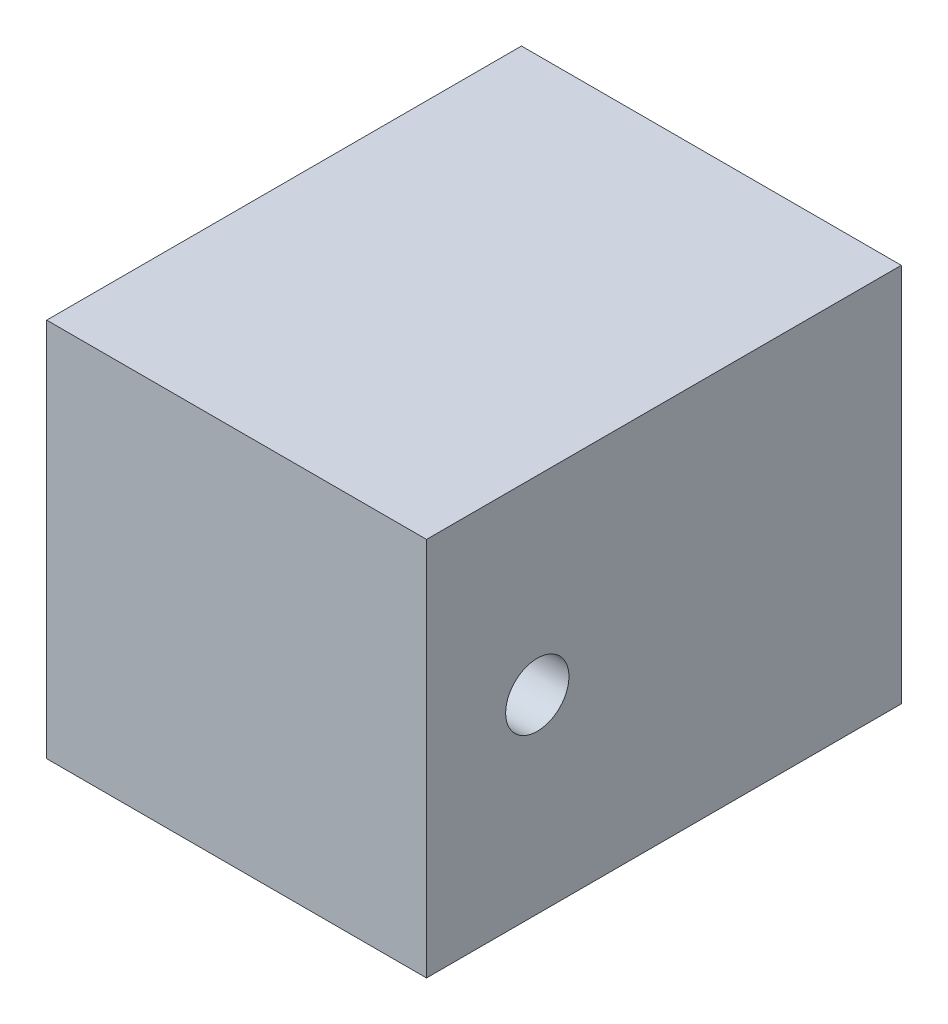
from build123d import *

# Parameters (mm, degrees)
SKETCH_1_W          = 12
SKETCH_1_H          = 12
SKETCH_1_W_2        = 10
SKETCH_1_H_2        = 10
EXTRUDE_1_DEPTH     = 10
SKETCH_2_W          = 12
SKETCH_2_H          = 12
EXTRUDE_2_DEPTH     = 5
SKETCH_3_R          = 1
CUT_EXTRUDE_1_DEPTH = 12


with BuildPart() as part:
    # 草图1 → 凸台-拉伸1 (new body)
    with BuildSketch(Plane.XY):
        with Locations((6, 6)):
            Rectangle(SKETCH_1_W, SKETCH_1_H)
        with Locations((6, 6)):
            Rectangle(SKETCH_1_W_2, SKETCH_1_H_2, mode=Mode.SUBTRACT)
    extrude(amount=EXTRUDE_1_DEPTH)

    # 草图2 → 凸台-拉伸2 (add)
    with BuildSketch(Plane.XY.offset(10)):
        with Locations((6, 6)):
            Rectangle(SKETCH_2_W, SKETCH_2_H)
    extrude(amount=EXTRUDE_2_DEPTH)

    # 草图3 → 切除-拉伸1 (cut)
    with BuildSketch(Plane.ZY):
        with Locations((11.5, 6)):
            Circle(SKETCH_3_R)
    extrude(amount=-CUT_EXTRUDE_1_DEPTH, mode=Mode.SUBTRACT)


solid = part.part
